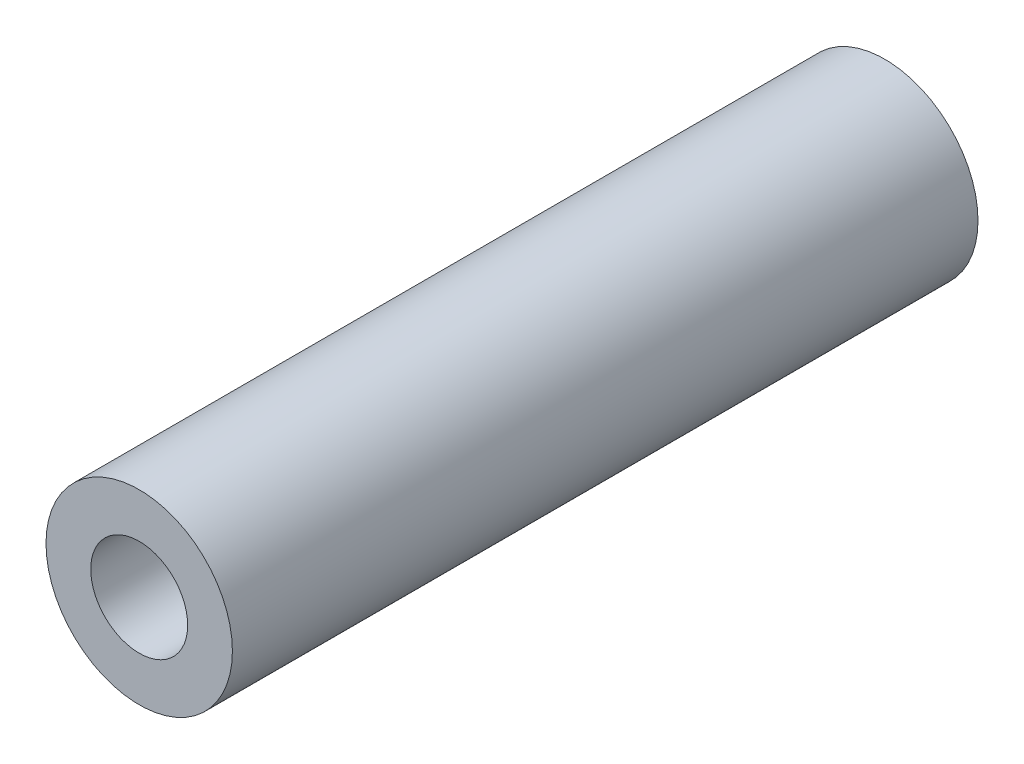
from build123d import *

# Parameters (mm, degrees)
SKETCH1_R           = 6.35
SKETCH1_R_2         = 3.302
BOSS_EXTRUDE1_DEPTH = 50.8


with BuildPart() as part:
    # Sketch1 → Boss-Extrude1 (new body)
    with BuildSketch(Plane.XY):
        Circle(SKETCH1_R)
        Circle(SKETCH1_R_2, mode=Mode.SUBTRACT)
    extrude(amount=BOSS_EXTRUDE1_DEPTH)


solid = part.part
